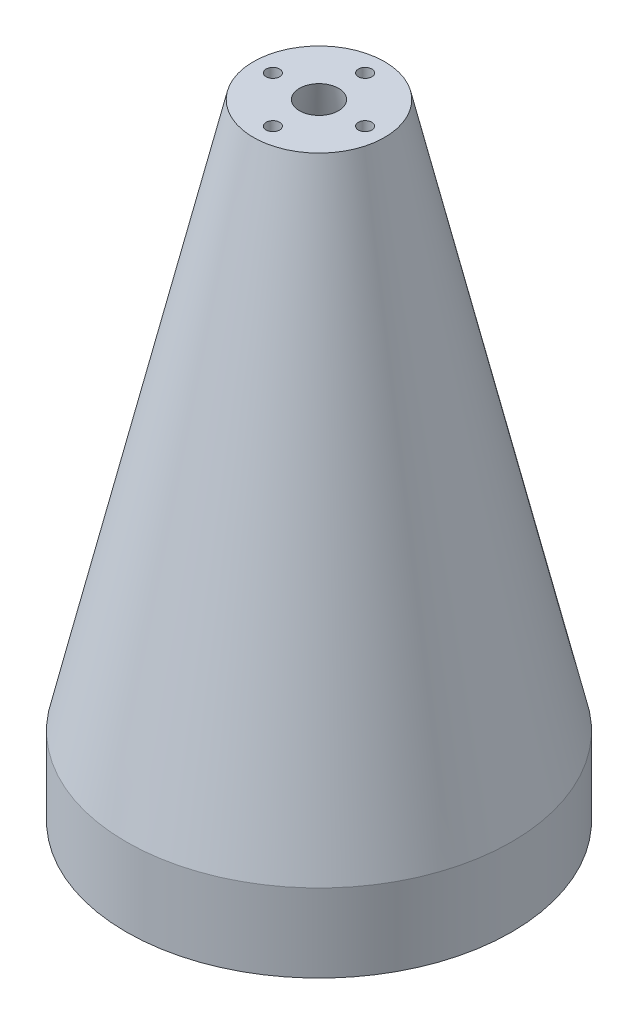
from build123d import *

# Parameters (mm, degrees)
SKETCH3_R          = 2.2
CUT_EXTRUDE1_DEPTH = 10
SKETCH4_R          = 2.2
CUT_EXTRUDE2_DEPTH = 10


with BuildPart() as part:
    # Sketch2 → Revolve1 (revolve)
    with BuildSketch(Plane.XY, mode=Mode.PRIVATE) as revolve1_sk:
        Polygon((50.8635, 0), (62.6885, 0), (62.6885, 25.4), (21.35, 203.2), (6.35, 203.2), (47.6885, 25.4), (47.6885, 4.064), (50.8635, 4.064), align=None)
    revolve(revolve1_sk.sketch.rotate(Axis((0, 0, 0), (0, 1, 0)), 90), axis=Axis((0, 0, 0), (0, 1, 0)))

    # Sketch3 → Cut-Extrude1 (cut)
    with BuildSketch(Plane.XZ):
        with Locations(Location((-57.9825, 0, 0), (0, 0, 270))):
            Circle(SKETCH3_R)
        with Locations(Location((0, 57.9825, 0), (0, 0, 270))):
            Circle(SKETCH3_R)
        with Locations(Location((57.9825, 0, 0), (0, 0, 270))):
            Circle(SKETCH3_R)
        with Locations(Location((0, -57.9825, 0), (0, 0, 270))):
            Circle(SKETCH3_R)
    extrude(amount=-CUT_EXTRUDE1_DEPTH, mode=Mode.SUBTRACT)

    # Sketch4 → Cut-Extrude2 (cut)
    with BuildSketch(Plane(origin=(0, 203.2, 0), x_dir=(1, 0, 0), z_dir=(0, 1, 0))):
        with Locations(Location((-15, 0, 0), (0, 0, 270))):
            Circle(SKETCH4_R)
        with Locations(Location((0, 15, 0), (0, 0, 270))):
            Circle(SKETCH4_R)
        with Locations(Location((15, 0, 0), (0, 0, 270))):
            Circle(SKETCH4_R)
        with Locations(Location((0, -15, 0), (0, 0, 270))):
            Circle(SKETCH4_R)
    extrude(amount=-CUT_EXTRUDE2_DEPTH, mode=Mode.SUBTRACT)


solid = part.part
